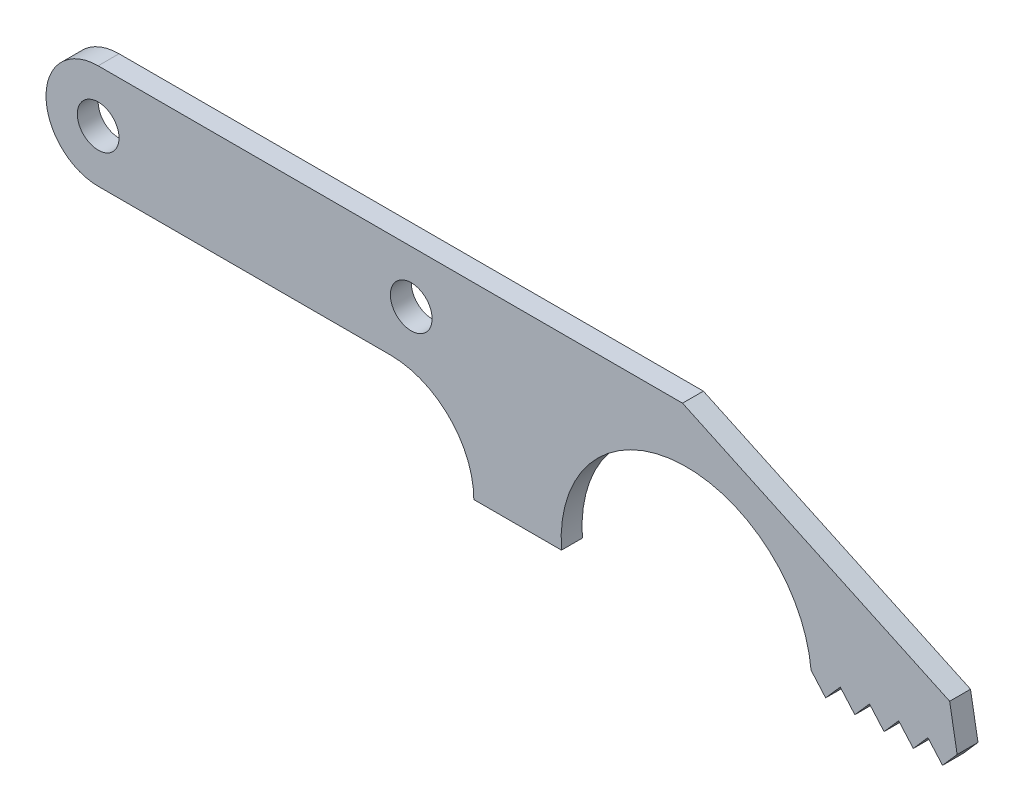
from build123d import *

# Parameters (mm, degrees)
SKETCH1_R           = 5
BOSS_EXTRUDE1_DEPTH = 2.5


with BuildPart() as part:
    # Sketch1 → Boss-Extrude1 (new, symmetric)
    with BuildSketch(Plane.XY):
        with BuildLine():
            Line((0, 25), (140, 25))
            Line((140, 25), (203.998392257, -4.842940419))
            Line((203.998392257, -4.842940419), (205.789355906, -15))
            Line((205.789355906, -15), (202.289355906, -19))
            Line((202.289355906, -19), (198.789355906, -15))
            Line((198.789355906, -15), (195.289355906, -19))
            Line((195.289355906, -19), (191.789355906, -15))
            Line((191.789355906, -15), (188.289355906, -19))
            Line((188.289355906, -19), (184.789355906, -15))
            Line((184.789355906, -15), (181.289355906, -19))
            Line((181.289355906, -19), (177.789355906, -15))
            Line((177.789355906, -15), (174.289355906, -19))
            Line((174.289355906, -19), (170.789355906, -15))
            ThreePointArc((170.789355906, -15), (138.414706816, 12.155175392), (111, -20))
            Line((111, -20), (90, -20))
            ThreePointArc((90, -20), (84.142135624, -5.857864376), (70, 0))
            Line((70, 0), (0, 0))
            ThreePointArc((0, 0), (-12.5, 12.5), (0, 25))
        make_face()
        with Locations((75, 12.5)):
            Circle(SKETCH1_R, mode=Mode.SUBTRACT)
        with Locations((0, 12.5)):
            Circle(SKETCH1_R, mode=Mode.SUBTRACT)
    extrude(amount=BOSS_EXTRUDE1_DEPTH, both=True)


solid = part.part
